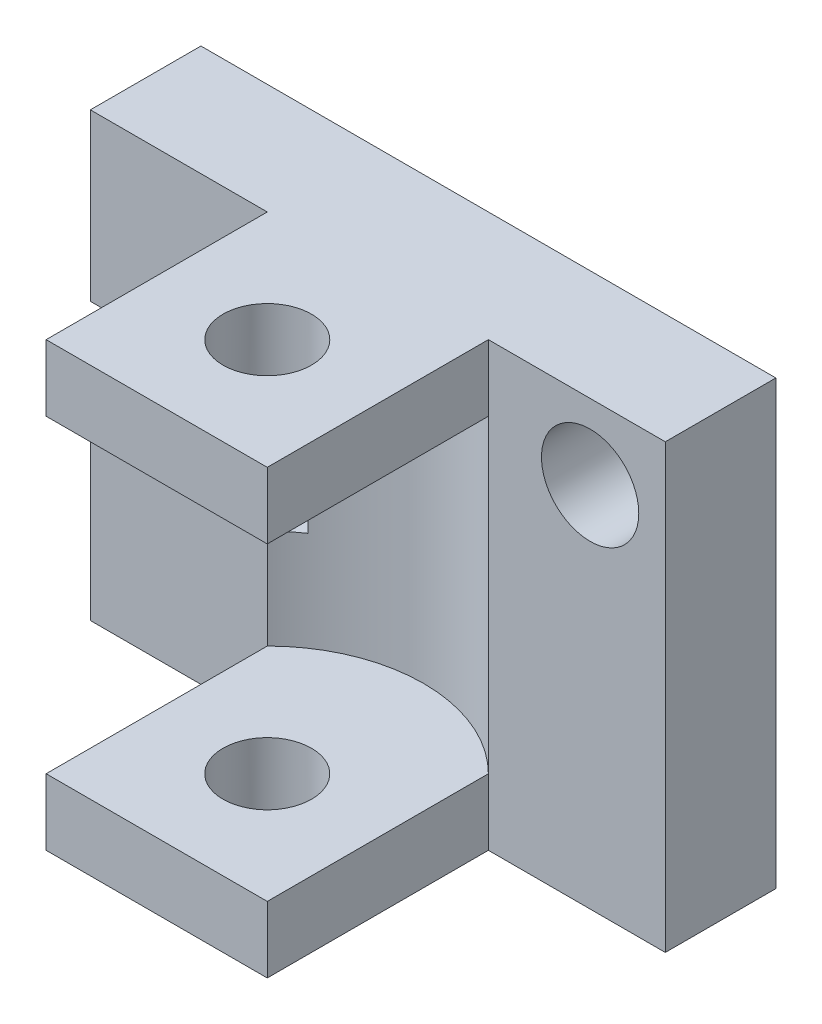
from build123d import *

# Parameters (mm, degrees)
SKETCH_1_W          = 130
SKETCH_1_H          = 100
EXTRUDE_1_DEPTH     = 25
SKETCH_2_W          = 50
SKETCH_2_H          = 50
SKETCH_2_R          = 10
EXTRUDE_2_DEPTH     = 100
SKETCH_3_R          = 11
CUT_EXTRUDE_1_DEPTH = 97.046863561
SKETCH_4_R          = 35.355339059
CUT_EXTRUDE_2_DEPTH = 35
SKETCH_5_W          = 45
SKETCH_5_H          = 25
CUT_EXTRUDE_3_DEPTH = 15


with BuildPart() as part:
    # Эскиз1 → Бобышка-Вытянуть1 (new body)
    with BuildSketch(Plane.XY):
        Rectangle(SKETCH_1_W, SKETCH_1_H)
    extrude(amount=EXTRUDE_1_DEPTH)

    # Эскиз2 → Бобышка-Вытянуть2 (add)
    with BuildSketch(Plane(origin=(0, 50, 0), x_dir=(1, 0, 0), z_dir=(0, 1, 0))):
        with Locations((0, -50)):
            Rectangle(SKETCH_2_W, SKETCH_2_H)
        with Locations(Location((0, -50, 0), (0, 0, 270))):
            Circle(SKETCH_2_R, mode=Mode.SUBTRACT)
    extrude(amount=-EXTRUDE_2_DEPTH)

    # Эскиз3 → Вырез-Вытянуть1 (cut, through all)
    with BuildSketch(Plane.XY.offset(25)):
        with Locations((48, 33)):
            Circle(SKETCH_3_R)
    extrude(amount=-CUT_EXTRUDE_1_DEPTH, mode=Mode.SUBTRACT)

    # Эскиз4 → Вырез-Вытянуть2 (cut, symmetric)
    with BuildSketch(Plane(origin=(0, 0, 0), x_dir=(-1, 0, 0), z_dir=(0, -1, 0))):
        with Locations((0, -50)):
            Circle(SKETCH_4_R)
    extrude(amount=CUT_EXTRUDE_2_DEPTH, both=True, mode=Mode.SUBTRACT)

    # Эскиз5 → Вырез-Вытянуть3 (cut)
    with BuildSketch(Plane.XY.offset(25)):
        with Locations((-42.5, 0)):
            Rectangle(SKETCH_5_W, SKETCH_5_H)
    extrude(amount=-CUT_EXTRUDE_3_DEPTH, mode=Mode.SUBTRACT)


solid = part.part
